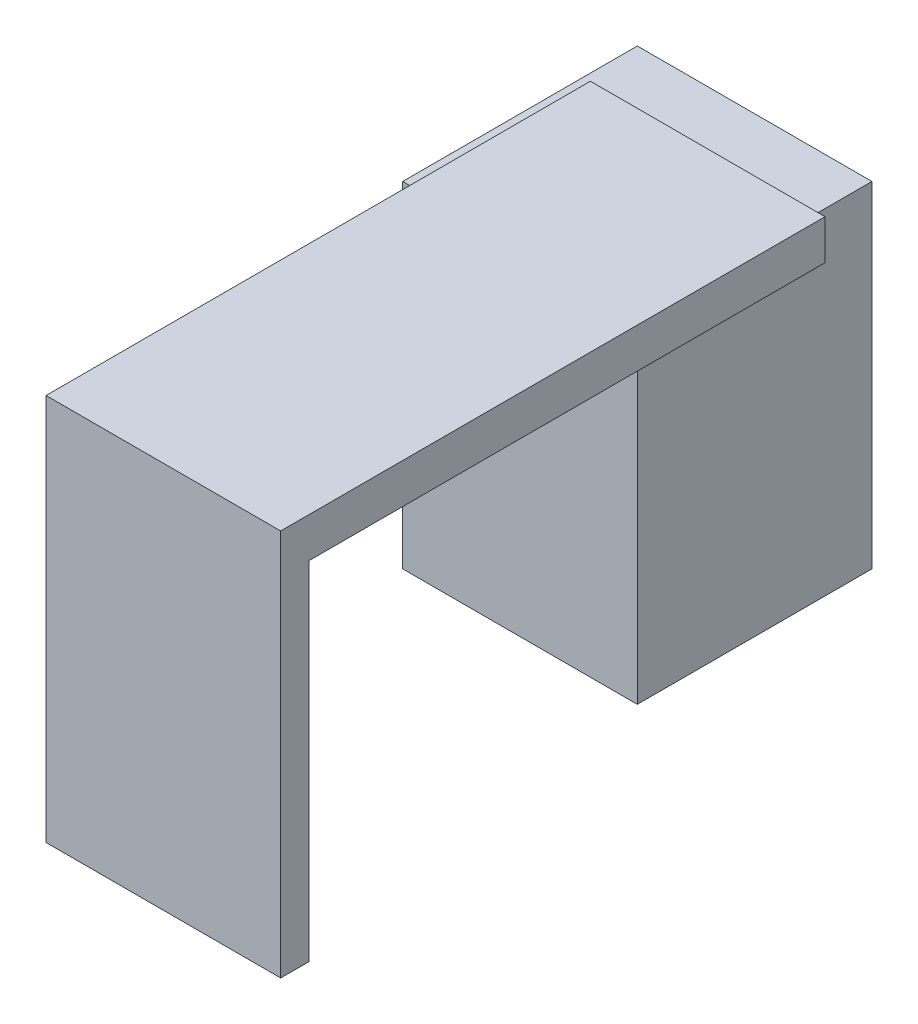
from build123d import *

# Parameters (mm, degrees)
BOSS_EXTRUDE1_DEPTH = 250
SKETCH3_W           = 450
SKETCH3_H           = 450
BOSS_EXTRUDE2_DEPTH = 740
BOSS_EXTRUDE3_START = 25
SKETCH3_3_W         = 500
SKETCH3_3_H         = 500
SKETCH3_3_W_2       = 450
SKETCH3_3_H_2       = 450
BOSS_EXTRUDE3_DEPTH = 715
SKETCH4_W           = 500
SKETCH4_H           = 1160
BOSS_EXTRUDE4_DEPTH = 25


with BuildPart() as part:
    # Sketch2 → Boss-Extrude1 (new, symmetric)
    with BuildSketch(Plane(origin=(0, 0, 0), x_dir=(0, 0, -1), z_dir=(1, 0, 0))):
        Polygon((0, 0), (0, 800), (1160, 800), (1160, 740), (60, 740), (60, 0), align=None)
    extrude(amount=BOSS_EXTRUDE1_DEPTH, both=True)

    # Sketch3 → Boss-Extrude2 (add)
    with BuildSketch(Plane(origin=(0, 0, 0), x_dir=(1, 0, 0), z_dir=(0, 1, 0))):
        with Locations((-100, 1110)):
            Rectangle(SKETCH3_W, SKETCH3_H)
    extrude(amount=BOSS_EXTRUDE2_DEPTH)

    # Sketch3<3> → Boss-Extrude3 (add)
    with BuildSketch(Plane(origin=(0, 0, 0), x_dir=(1, 0, 0), z_dir=(0, 1, 0)).offset(BOSS_EXTRUDE3_START)):
        with Locations((-100, 1110)):
            Rectangle(SKETCH3_3_W, SKETCH3_3_H)
        with Locations((-100, 1110)):
            Rectangle(SKETCH3_3_W_2, SKETCH3_3_H_2, mode=Mode.SUBTRACT)
    extrude(amount=BOSS_EXTRUDE3_DEPTH)

    # Sketch4 → Boss-Extrude4 (add)
    with BuildSketch(Plane(origin=(0, 800, 0), x_dir=(1, 0, 0), z_dir=(0, 1, 0))):
        with Locations((0, 580)):
            Rectangle(SKETCH4_W, SKETCH4_H)
    extrude(amount=BOSS_EXTRUDE4_DEPTH)


solid = part.part
